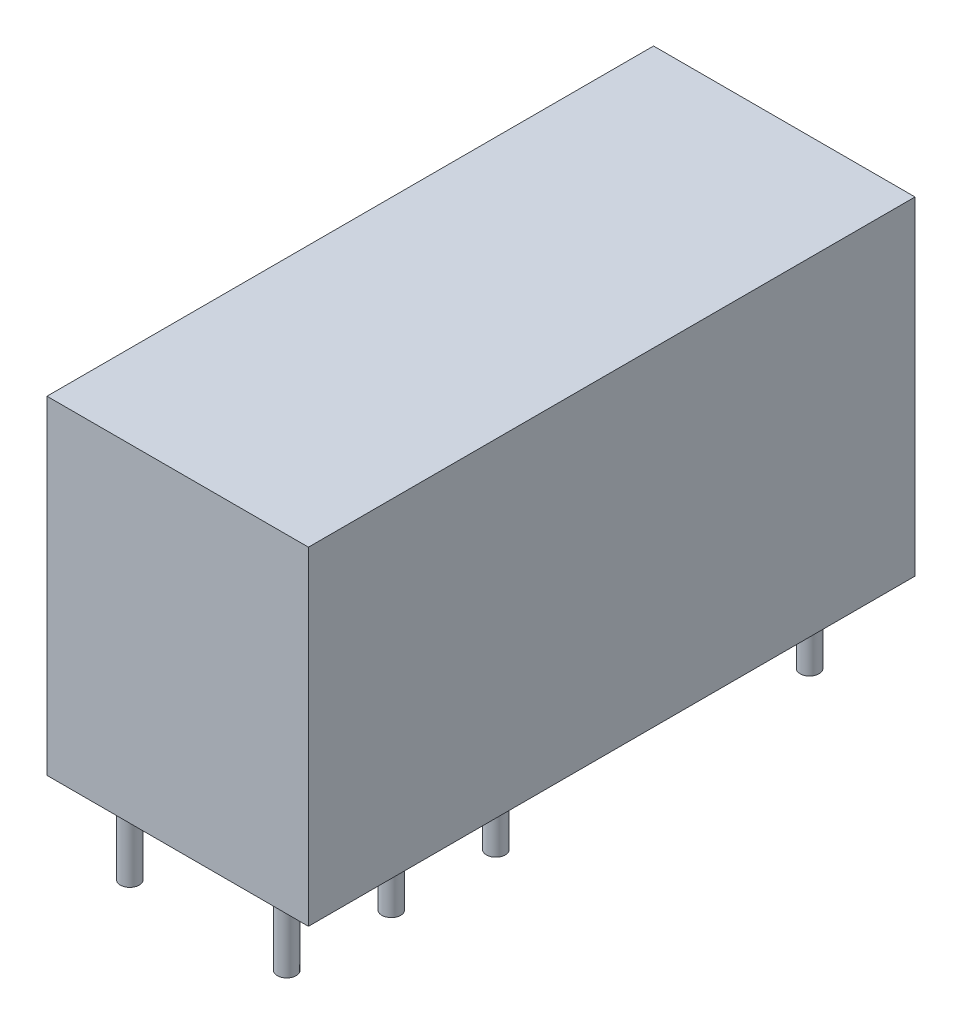
from build123d import *

# Parameters (mm, degrees)
SKETCH1_W           = 12.5
SKETCH1_H           = 29
BOSS_EXTRUDE1_DEPTH = 15.7
SKETCH2_R           = 0.45
BOSS_EXTRUDE2_DEPTH = 3.8


with BuildPart() as part:
    # Sketch1 → Boss-Extrude1 (new body)
    with BuildSketch(Plane(origin=(0, 0, 0), x_dir=(1, 0, 0), z_dir=(0, 1, 0))):
        Rectangle(SKETCH1_W, SKETCH1_H)
    extrude(amount=BOSS_EXTRUDE1_DEPTH)

    # Sketch2 → Boss-Extrude2 (add)
    with BuildSketch(Plane(origin=(0, 0, 0), x_dir=(1, 0, 0), z_dir=(0, 1, 0))):
        with Locations(Location((-3.75, -13.04, 0), (0, 0, 270))):
            Circle(SKETCH2_R)
        with Locations(Location((-3.75, -8.04, 0), (0, 0, 270))):
            Circle(SKETCH2_R)
        with Locations(Location((-3.75, -3.04, 0), (0, 0, 270))):
            Circle(SKETCH2_R)
        with Locations(Location((-3.75, 11.96, 0), (0, 0, 270))):
            Circle(SKETCH2_R)
        with Locations(Location((3.75, 11.96, 0), (0, 0, 90))):
            Circle(SKETCH2_R)
        with Locations(Location((3.75, -3.04, 0), (0, 0, 90))):
            Circle(SKETCH2_R)
        with Locations(Location((3.75, -8.04, 0), (0, 0, 90))):
            Circle(SKETCH2_R)
        with Locations(Location((3.75, -13.04, 0), (0, 0, 90))):
            Circle(SKETCH2_R)
    extrude(amount=-BOSS_EXTRUDE2_DEPTH)


solid = part.part
